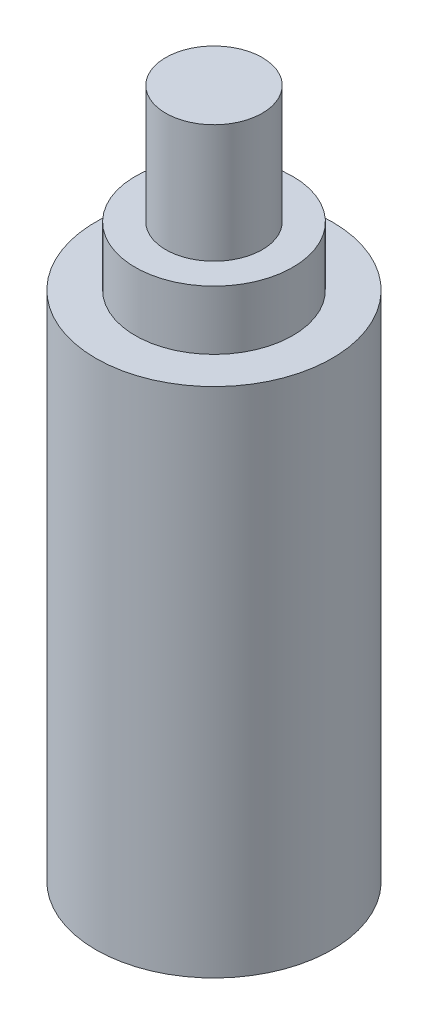
from build123d import *

# Parameters (mm, degrees)
SKETCH3_R           = 7.62
BOSS_EXTRUDE1_DEPTH = 33.02
SKETCH4_R           = 5.08
BOSS_EXTRUDE2_DEPTH = 3.81
SKETCH5_R           = 3.1115
BOSS_EXTRUDE3_DEPTH = 7.62


with BuildPart() as part:
    # Sketch3 → Boss-Extrude1 (new body)
    with BuildSketch(Plane(origin=(0, 0, 0), x_dir=(1, 0, 0), z_dir=(0, 1, 0))):
        with Locations(Location((-15.24, 15.24, 0), (0, 0, 270))):
            Circle(SKETCH3_R)
    extrude(amount=BOSS_EXTRUDE1_DEPTH)

    # Sketch4 → Boss-Extrude2 (add)
    with BuildSketch(Plane(origin=(0, 33.02, 0), x_dir=(1, 0, 0), z_dir=(0, 1, 0))):
        with Locations(Location((-15.24, 15.24, 0), (0, 0, 90))):
            Circle(SKETCH4_R)
    extrude(amount=BOSS_EXTRUDE2_DEPTH)

    # Sketch5 → Boss-Extrude3 (add)
    with BuildSketch(Plane(origin=(0, 36.83, 0), x_dir=(1, 0, 0), z_dir=(0, 1, 0))):
        with Locations(Location((-15.24, 15.24, 0), (0, 0, 90))):
            Circle(SKETCH5_R)
    extrude(amount=BOSS_EXTRUDE3_DEPTH)


solid = part.part
